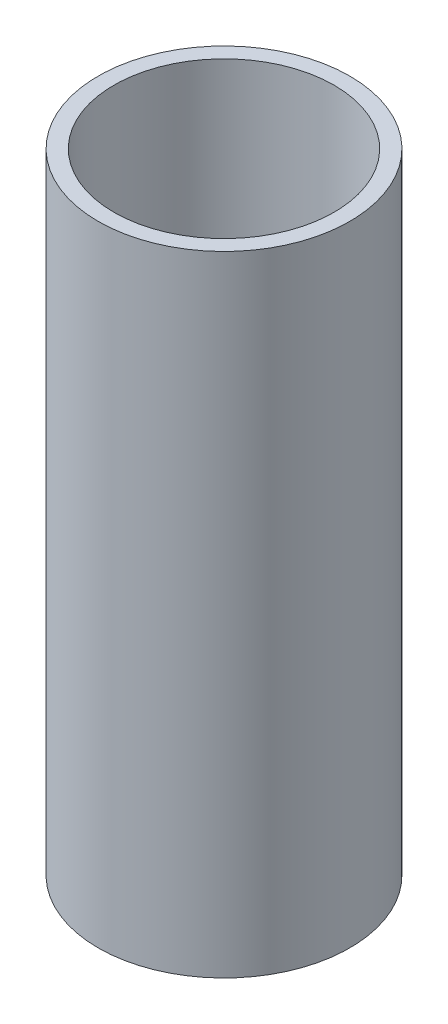
from build123d import *

# Parameters (mm, degrees)
SKETCH1_R           = 40
SKETCH1_R_2         = 35
BOSS_EXTRUDE1_DEPTH = 200


with BuildPart() as part:
    # Sketch1 → Boss-Extrude1 (new body)
    with BuildSketch(Plane(origin=(0, 0, 0), x_dir=(1, 0, 0), z_dir=(0, 1, 0))):
        with Locations(Location((0, 0, 0), (0, 0, 270))):
            Circle(SKETCH1_R)
        with Locations(Location((0, 0, 0), (0, 0, 270))):
            Circle(SKETCH1_R_2, mode=Mode.SUBTRACT)
    extrude(amount=BOSS_EXTRUDE1_DEPTH)


solid = part.part
